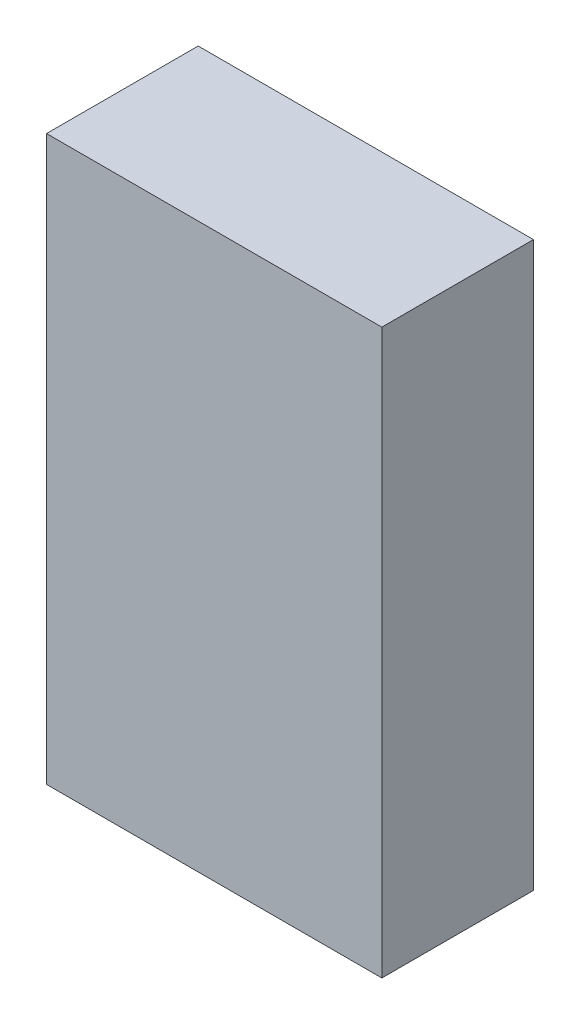
from build123d import *

# Parameters (mm, degrees)
SKETCH1_W      = 34.5
SKETCH1_H      = 58
ENVELOPE_DEPTH = 15.6


with BuildPart() as part:
    # Sketch1 → Envelope (new body)
    with BuildSketch(Plane.XY):
        Rectangle(SKETCH1_W, SKETCH1_H)
    extrude(amount=ENVELOPE_DEPTH)


solid = part.part
